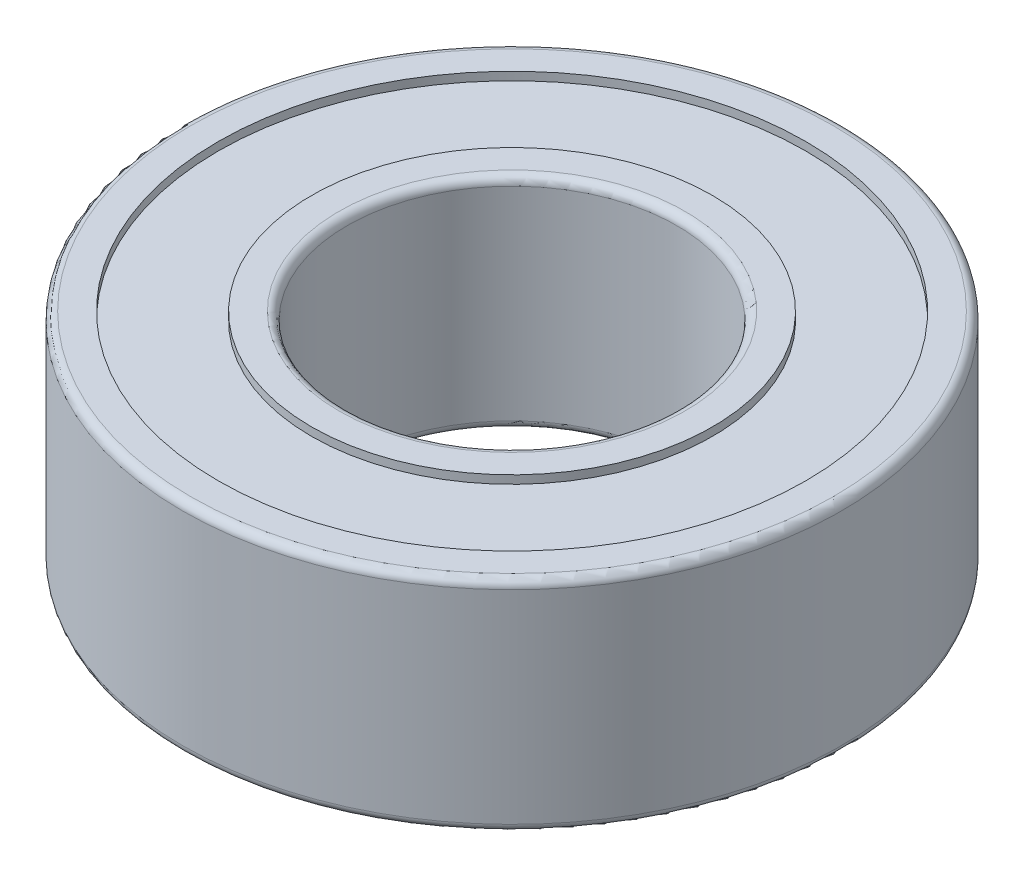
from build123d import *


with BuildPart() as part:
    # Esquisse1 → Révolution1 (revolve)
    with BuildSketch(Plane(origin=(0, 0, 0), x_dir=(-1, 0, 0), z_dir=(0, 0, -1)), mode=Mode.PRIVATE) as r_volution1_sk:
        with BuildLine():
            Line((-3, -1.85), (-3, 1.85))
            ThreePointArc((-3, 1.85), (-3.043933983, 1.956066017), (-3.15, 2))
            Line((-3.15, 2), (-3.65, 2))
            Line((-3.65, 2), (-3.65, 1.85))
            Line((-3.65, 1.85), (-5.35, 1.85))
            Line((-5.35, 1.85), (-5.35, 2))
            Line((-5.35, 2), (-5.85, 2))
            ThreePointArc((-5.85, 2), (-5.956066017, 1.956066017), (-6, 1.85))
            Line((-6, 1.85), (-6, -1.85))
            ThreePointArc((-6, -1.85), (-5.956066017, -1.956066017), (-5.85, -2))
            Line((-5.85, -2), (-5.35, -2))
            Line((-5.35, -2), (-5.35, -1.85))
            Line((-5.35, -1.85), (-3.65, -1.85))
            Line((-3.65, -1.85), (-3.65, -2))
            Line((-3.65, -2), (-3.15, -2))
            ThreePointArc((-3.15, -2), (-3.043933983, -1.956066017), (-3, -1.85))
        make_face()
    revolve(r_volution1_sk.sketch.rotate(Axis((0, -2.003446066, 0), (0, 1, 0)), 270), axis=Axis((0, -2.003446066, 0), (0, 1, 0)))


solid = part.part
